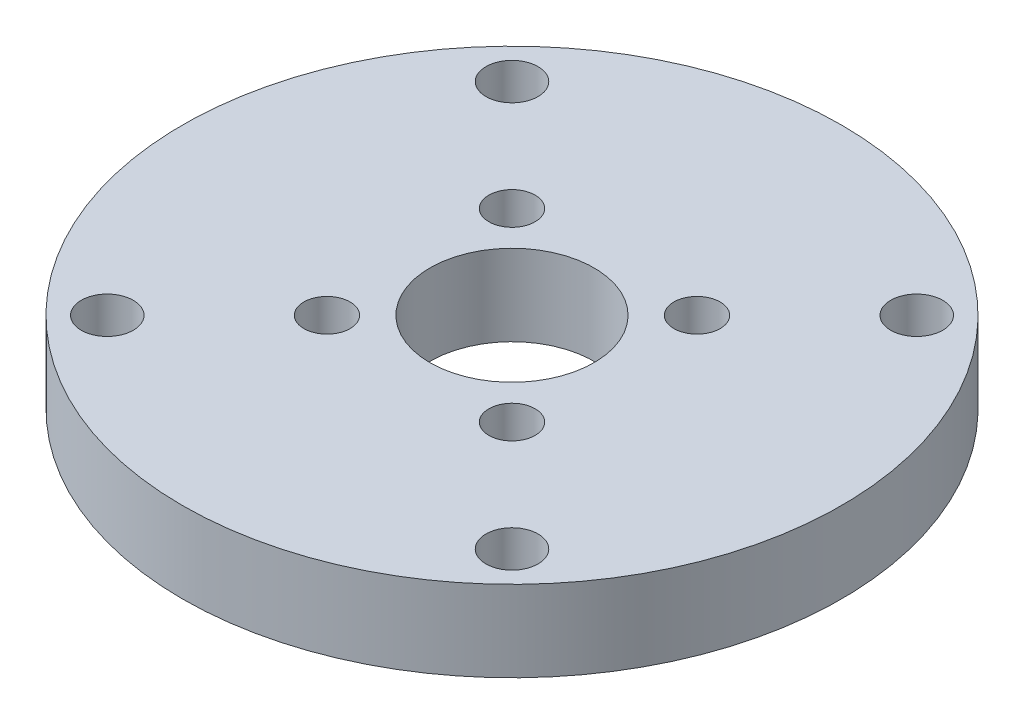
from build123d import *

# Parameters (mm, degrees)
SKETCH1_R           = 28.5
BOSS_EXTRUDE1_DEPTH = 3.5
SKETCH2_R           = 2.25
SKETCH2_R_2         = 2
CUT_EXTRUDE1_DEPTH  = 41.908434338
SKETCH3_R           = 7.1
CUT_EXTRUDE2_DEPTH  = 41.908434338


with BuildPart() as part:
    # Sketch1 → Boss-Extrude1 (new, symmetric)
    with BuildSketch(Plane(origin=(0, 0, 0), x_dir=(1, 0, 0), z_dir=(0, 1, 0))):
        with Locations(Location((0, 0, 0), (0, 0, 270))):
            Circle(SKETCH1_R)
    extrude(amount=BOSS_EXTRUDE1_DEPTH, both=True)

    # Sketch2 → Cut-Extrude1 (cut, through all)
    with BuildSketch(Plane(origin=(0, 3.5, 0), x_dir=(1, 0, 0), z_dir=(0, 1, 0))):
        with Locations(Location((17.500892834, 17.500892834, 0), (0, 0, 270))):
            Circle(SKETCH2_R)
        with Locations(Location((17.500892834, -17.500892834, 0), (0, 0, 270))):
            Circle(SKETCH2_R)
        with Locations(Location((-17.500892834, -17.500892834, 0), (0, 0, 270))):
            Circle(SKETCH2_R)
        with Locations(Location((-17.500892834, 17.500892834, 0), (0, 0, 270))):
            Circle(SKETCH2_R)
        with Locations(Location((-8, -8, 0), (0, 0, 270))):
            Circle(SKETCH2_R_2)
        with Locations(Location((-8, 8, 0), (0, 0, 270))):
            Circle(SKETCH2_R_2)
        with Locations(Location((8, 8, 0), (0, 0, 270))):
            Circle(SKETCH2_R_2)
        with Locations(Location((8, -8, 0), (0, 0, 270))):
            Circle(SKETCH2_R_2)
    extrude(amount=-CUT_EXTRUDE1_DEPTH, mode=Mode.SUBTRACT)

    # Sketch3 → Cut-Extrude2 (cut, through all)
    with BuildSketch(Plane(origin=(0, 3.5, 0), x_dir=(1, 0, 0), z_dir=(0, 1, 0))):
        with Locations(Location((0, 0, 0), (0, 0, 270))):
            Circle(SKETCH3_R)
    extrude(amount=-CUT_EXTRUDE2_DEPTH, mode=Mode.SUBTRACT)


solid = part.part
